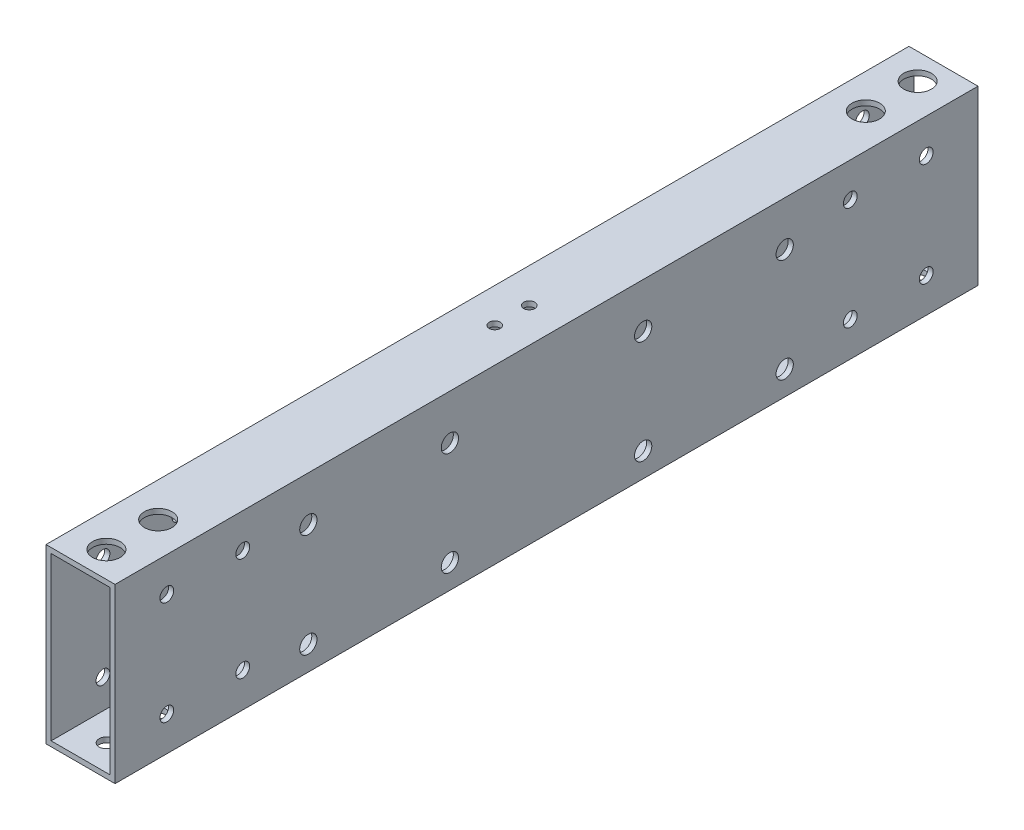
from build123d import *

# Parameters (mm, degrees)
SKETCH_1_W          = 20
SKETCH_1_H          = 50
SKETCH_1_W_2        = 17
SKETCH_1_H_2        = 47
EXTRUDE_1_DEPTH     = 250
SKETCH_2_R          = 2.5
CUT_EXTRUDE_1_DEPTH = 253.041663223
SKETCH_3_R          = 2.1
CUT_EXTRUDE_2_DEPTH = 256.147016443
SKETCH_4_R          = 1.6
CUT_EXTRUDE_3_DEPTH = 10
SKETCH_5_R          = 4
CUT_EXTRUDE_4_DEPTH = 10
SKETCH_6_R          = 7.5
CUT_EXTRUDE_5_DEPTH = 10
SKETCH_7_R          = 2
CUT_EXTRUDE_6_DEPTH = 253.041663223


with BuildPart() as part:
    # 草图1 → 凸台-拉伸1 (new body)
    with BuildSketch(Plane.XY):
        Rectangle(SKETCH_1_W, SKETCH_1_H)
        Rectangle(SKETCH_1_W_2, SKETCH_1_H_2, mode=Mode.SUBTRACT)
    extrude(amount=-EXTRUDE_1_DEPTH)

    # 草图2 → 切除-拉伸1 (cut, through all)
    with BuildSketch(Plane.ZY.offset(10)):
        with Locations((-56, 12)):
            Circle(SKETCH_2_R)
        with Locations(Location((-97, 12, 0), (0, 0, 180))):
            Circle(SKETCH_2_R)
        with Locations((-97, -18)):
            Circle(SKETCH_2_R)
        with Locations(Location((-56, -18, 0), (0, 0, 180))):
            Circle(SKETCH_2_R)
        with Locations((-194, -18)):
            Circle(SKETCH_2_R)
        with Locations(Location((-153, -18, 0), (0, 0, 180))):
            Circle(SKETCH_2_R)
        with Locations((-153, 12)):
            Circle(SKETCH_2_R)
        with Locations(Location((-194, 12, 0), (0, 0, 180))):
            Circle(SKETCH_2_R)
    extrude(amount=-CUT_EXTRUDE_1_DEPTH, mode=Mode.SUBTRACT)

    # 草图3 → 切除-拉伸2 (cut, through all)
    with BuildSketch(Plane(origin=(0, 25, 0), x_dir=(1, 0, 0), z_dir=(0, 1, 0))):
        with Locations(Location((0, 22.5, 0), (0, 0, 270))):
            Circle(SKETCH_3_R)
        with Locations(Location((0, 7.5, 0), (0, 0, 270))):
            Circle(SKETCH_3_R)
        with Locations(Location((0, 242.5, 0), (0, 0, 90))):
            Circle(SKETCH_3_R)
        with Locations(Location((0, 227.5, 0), (0, 0, 90))):
            Circle(SKETCH_3_R)
    extrude(amount=-CUT_EXTRUDE_2_DEPTH, mode=Mode.SUBTRACT)

    # 草图4 → 切除-拉伸3 (cut)
    with BuildSketch(Plane(origin=(0, 25, 0), x_dir=(1, 0, 0), z_dir=(0, 1, 0))):
        with Locations(Location((0, 130, 0), (0, 0, 270))):
            Circle(SKETCH_4_R)
        with Locations(Location((0, 120, 0), (0, 0, 270))):
            Circle(SKETCH_4_R)
    extrude(amount=-CUT_EXTRUDE_3_DEPTH, mode=Mode.SUBTRACT)

    # 草图5 → 切除-拉伸4 (cut)
    with BuildSketch(Plane(origin=(0, 25, 0), x_dir=(1, 0, 0), z_dir=(0, 1, 0))):
        with Locations(Location((0, 22.5, 0), (0, 0, 270))):
            Circle(SKETCH_5_R)
        with Locations(Location((0, 7.5, 0), (0, 0, 270))):
            Circle(SKETCH_5_R)
        with Locations(Location((0, 242.5, 0), (0, 0, 270))):
            Circle(SKETCH_5_R)
        with Locations(Location((0, 227.5, 0), (0, 0, 270))):
            Circle(SKETCH_5_R)
    extrude(amount=-CUT_EXTRUDE_4_DEPTH, mode=Mode.SUBTRACT)

    # 草图6 → 切除-拉伸5 (cut)
    with BuildSketch(Plane.ZY.offset(10)):
        with Locations((-125, -4)):
            Circle(SKETCH_6_R)
    extrude(amount=-CUT_EXTRUDE_5_DEPTH, mode=Mode.SUBTRACT)

    # 草图7 → 切除-拉伸6 (cut, through all)
    with BuildSketch(Plane.ZY.offset(10)):
        with Locations((-235, 15)):
            Circle(SKETCH_7_R)
        with Locations((-213, 15)):
            Circle(SKETCH_7_R)
        with Locations((-235, -15)):
            Circle(SKETCH_7_R)
        with Locations((-213, -15)):
            Circle(SKETCH_7_R)
        with Locations(Location((-37, -15, 0), (0, 0, 180))):
            Circle(SKETCH_7_R)
        with Locations(Location((-15, -15, 0), (0, 0, 180))):
            Circle(SKETCH_7_R)
        with Locations(Location((-37, 15, 0), (0, 0, 180))):
            Circle(SKETCH_7_R)
        with Locations(Location((-15, 15, 0), (0, 0, 180))):
            Circle(SKETCH_7_R)
    extrude(amount=-CUT_EXTRUDE_6_DEPTH, mode=Mode.SUBTRACT)


solid = part.part
